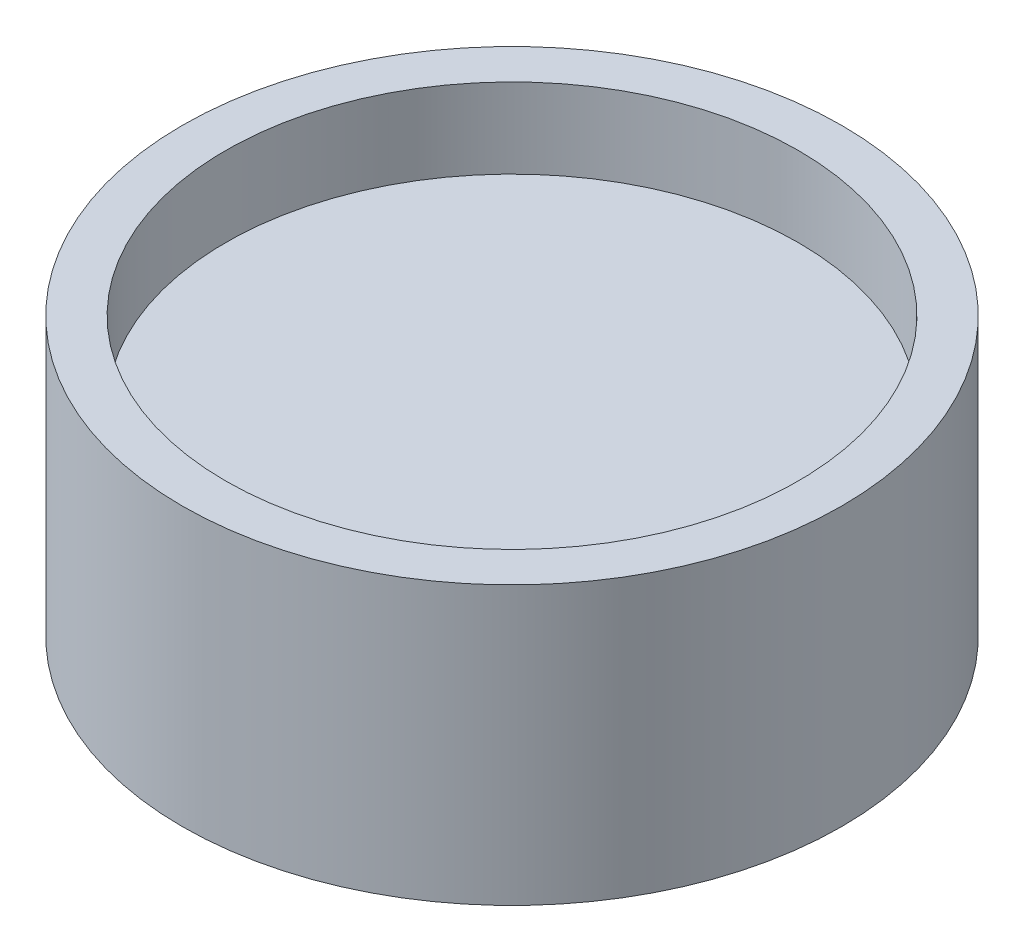
from build123d import *

# Parameters (mm, degrees)
SKETCH_1_R          = 19
EXTRUDE_1_DEPTH     = 16
SKETCH_2_R          = 16.5
CUT_EXTRUDE_1_DEPTH = 4.6
SKETCH_3_R          = 16.4
CUT_EXTRUDE_2_DEPTH = 4.6


with BuildPart() as part:
    # 草图1 → 凸台-拉伸1 (new body)
    with BuildSketch(Plane(origin=(0, 0, 0), x_dir=(1, 0, 0), z_dir=(0, 1, 0))):
        with Locations(Location((0, 0, 0), (0, 0, 270))):
            Circle(SKETCH_1_R)
    extrude(amount=EXTRUDE_1_DEPTH)

    # 草图2 → 切除-拉伸1 (cut)
    with BuildSketch(Plane(origin=(0, 16, 0), x_dir=(1, 0, 0), z_dir=(0, 1, 0))):
        with Locations(Location((0, 0, 0), (0, 0, 270))):
            Circle(SKETCH_2_R)
    extrude(amount=-CUT_EXTRUDE_1_DEPTH, mode=Mode.SUBTRACT)

    # 草图3 → 切除-拉伸2 (cut)
    with BuildSketch(Plane.XZ):
        with Locations(Location((0, 0, 0), (0, 0, 270))):
            Circle(SKETCH_3_R)
    extrude(amount=-CUT_EXTRUDE_2_DEPTH, mode=Mode.SUBTRACT)


solid = part.part
